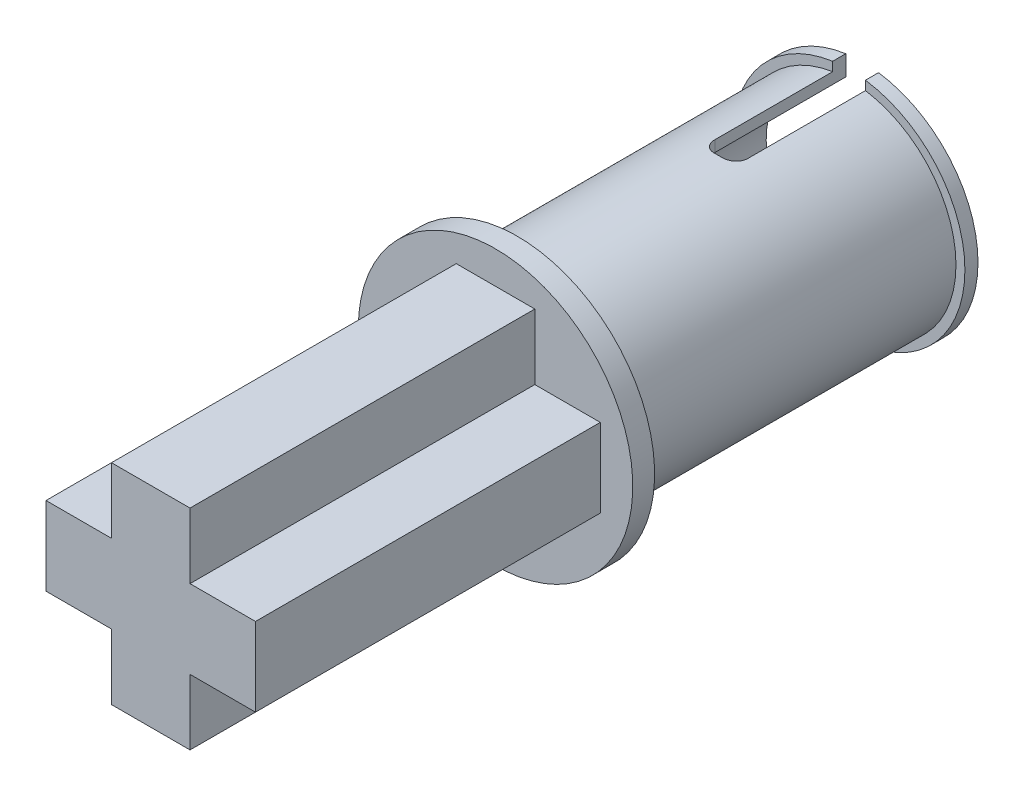
from build123d import *

# Parameters (mm, degrees)
BOSS_EXTRUDE1_DEPTH = 7.9
SKETCH2_R           = 3.144549921
BOSS_EXTRUDE3_DEPTH = 0.5
SKETCH3_R           = 2.45
BOSS_EXTRUDE4_DEPTH = 7.9
SKETCH4_R           = 2.65462565
BOSS_EXTRUDE5_DEPTH = 0.3
SKETCH5_R           = 2.198604039
CUT_EXTRUDE1_DEPTH  = 7.9
CUT_EXTRUDE2_DEPTH  = 3.3
FILLET1_R           = 0.3


with BuildPart() as part:
    # Sketch1 → Boss-Extrude1 (new body)
    with BuildSketch(Plane.XY):
        Polygon((-2.4, 0.9), (-2.4, 0), (0, 0), (0, 2.4), (-0.9, 2.4), (-0.9, 0.9), align=None)
        Polygon((0, 0), (-2.4, 0), (-2.4, -0.9), (-0.9, -0.9), (-0.9, -2.4), (0, -2.4), align=None)
        Polygon((0, 2.4), (0, 0), (2.4, 0), (2.4, 0.9), (0.9, 0.9), (0.9, 2.4), align=None)
        Polygon((2.4, 0), (0, 0), (0, -2.4), (0.9, -2.4), (0.9, -0.9), (2.4, -0.9), align=None)
    extrude(amount=BOSS_EXTRUDE1_DEPTH)

    # Sketch2 → Boss-Extrude3 (add)
    with BuildSketch(Plane(origin=(0, 0, 0), x_dir=(-1, 0, 0), z_dir=(0, 0, -1))):
        Circle(SKETCH2_R)
    extrude(amount=BOSS_EXTRUDE3_DEPTH)

    # Sketch3 → Boss-Extrude4 (add)
    with BuildSketch(Plane(origin=(0, 0, -0.5), x_dir=(-1, 0, 0), z_dir=(0, 0, -1))):
        Circle(SKETCH3_R)
    extrude(amount=BOSS_EXTRUDE4_DEPTH)

    # Sketch4 → Boss-Extrude5 (add)
    with BuildSketch(Plane(origin=(0, 0, -8.4), x_dir=(-1, 0, 0), z_dir=(0, 0, -1))):
        Circle(SKETCH4_R)
    extrude(amount=-BOSS_EXTRUDE5_DEPTH)

    # Sketch5 → Cut-Extrude1 (cut)
    with BuildSketch(Plane(origin=(0, 0, -8.4), x_dir=(-1, 0, 0), z_dir=(0, 0, -1))):
        Circle(SKETCH5_R)
    extrude(amount=-CUT_EXTRUDE1_DEPTH, mode=Mode.SUBTRACT)

    # Sketch6 → Cut-Extrude2 (cut)
    with BuildSketch(Plane(origin=(0, 0, -8.4), x_dir=(-1, 0, 0), z_dir=(0, 0, -1))):
        with BuildLine():
            Line((0.375484044, 2.166303638), (0.375484044, 2.627936276))
            ThreePointArc((0.375484044, 2.627936276), (0.188215694, 2.6479449), (0, 2.65462565))
            Line((0, 2.65462565), (0, 2.198604039))
            ThreePointArc((0, 2.198604039), (0.188435389, 2.190514055), (0.375484044, 2.166303638))
        make_face()
        with BuildLine():
            Line((0, 2.198604039), (0, 2.65462565))
            ThreePointArc((0, 2.65462565), (-0.188215694, 2.6479449), (-0.375484044, 2.627936276))
            Line((-0.375484044, 2.627936276), (-0.375484044, 2.166303638))
            ThreePointArc((-0.375484044, 2.166303638), (-0.188435389, 2.190514055), (0, 2.198604039))
        make_face()
        with BuildLine():
            ThreePointArc((0, -2.65462565), (0.188215694, -2.6479449), (0.375484044, -2.627936276))
            Line((0.375484044, -2.627936276), (0.375484044, -2.166303638))
            ThreePointArc((0.375484044, -2.166303638), (0, -2.198604039), (-0.375484044, -2.166303638))
            Line((-0.375484044, -2.166303638), (-0.375484044, -2.627936276))
            ThreePointArc((-0.375484044, -2.627936276), (-0.188215694, -2.6479449), (0, -2.65462565))
        make_face()
    extrude(amount=-CUT_EXTRUDE2_DEPTH, mode=Mode.SUBTRACT)

    # Fillet1
    fillet1_edges = [part.edges().sort_by_distance(p)[0] for p in [
        (0.375484044, 2.293679776, -5.1),
        (-0.375484044, 2.293679776, -5.1),
        (-0.375484044, -2.293679776, -5.1),
        (0.375484044, -2.293679776, -5.1),
    ]]
    fillet(fillet1_edges, radius=FILLET1_R)


solid = part.part
